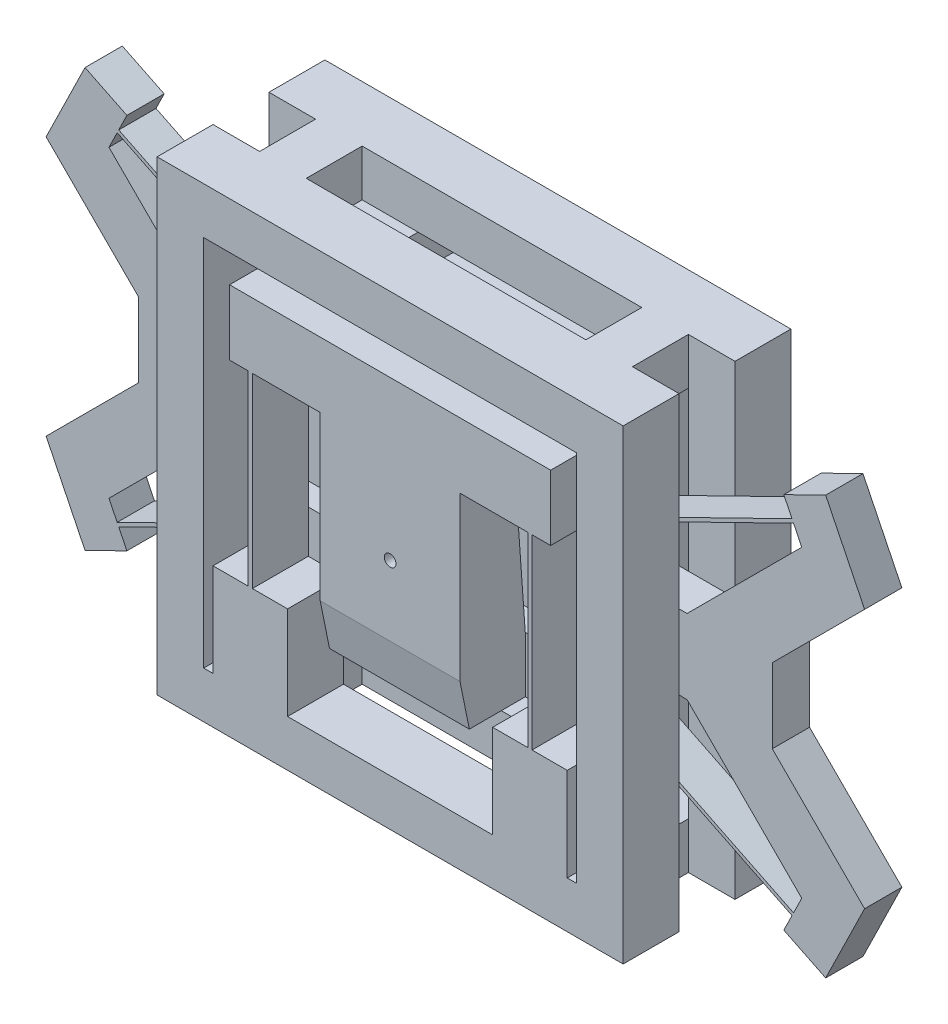
from build123d import *

# Parameters (mm, degrees)
SKETCH1_W           = 100
SKETCH1_H           = 100
BOSS_EXTRUDE1_DEPTH = 12
BOSS_EXTRUDE2_DEPTH = 30
BOSS_EXTRUDE3_DEPTH = 8
BOSS_EXTRUDE4_DEPTH = 30
SKETCH8_W           = 100
SKETCH8_H           = 100
BOSS_EXTRUDE5_DEPTH = 12
SKETCH9_W           = 10
SKETCH9_H           = 10
BOSS_EXTRUDE6_DEPTH = 12
SKETCH19_R          = 1.25
CUT_EXTRUDE3_DEPTH  = 6
CUT_EXTRUDE4_START  = -6
SKETCH20_R          = 1.25
CUT_EXTRUDE4_DEPTH  = 6


with BuildPart() as part:
    # Sketch1 → Boss-Extrude1 (new body)
    with BuildSketch(Plane.XY):
        Rectangle(SKETCH1_W, SKETCH1_H)
        Polygon((-20, -38), (-20, -30.45), (20, -30.45), (20, -34.45), (34, -34.45), (34, 34.45), (20, 34.45), (20, 30.45), (-20, 30.45), (-20, 38), (-40, 38), (-40, 40), (40, 40), (40, -40), (-40, -40), (-40, -38), align=None, mode=Mode.SUBTRACT)
        Polygon((-20, -29.55), (-20, -22), (-40, -22), (-40, 22), (-20, 22), (-20, 29.55), (20, 29.55), (20, 15), (-15, 15), (-15, -15), (20, -15), (20, -29.55), align=None, mode=Mode.SUBTRACT)
    extrude(amount=BOSS_EXTRUDE1_DEPTH)

    # Sketch3 → Boss-Extrude2 (add)
    with BuildSketch(Plane.ZY.offset(15)):
        Polygon((14, 12.85), (14, 24.85), (0, 15), (12, 15), (12, -15), align=None)
    extrude(amount=-BOSS_EXTRUDE2_DEPTH)

    # Sketch4 → Boss-Extrude3 (add)
    with BuildSketch(Plane.XY.offset(14)):
        Polygon((-15, 12.85), (-15, 24.85), (-33.36063033, 24.85), (-36.135022811, 19.186760341), (-72.235731357, 36.872314969), (-70.475974677, 40.464425272), (-79.456250435, 44.863816971), (-87.810556524, 27.810556524), (-68, 8), (-68, 0), (-60, 0), (0, 0), (0, 8), (-49.718758429, 8), (-74.325442414, 32.606683984), (-72.565685734, 36.198794287), (-36.464977189, 18.513239659), (-39.23936967, 12.85), align=None)
        Polygon((15, 24.85), (15, 12.85), (39.23936967, 12.85), (36.464977189, 18.513239659), (72.565685734, 36.198794287), (74.325442414, 32.606683984), (49.718758429, 8), (0, 8), (0, 0), (60, 0), (68, 0), (68, 8), (87.810556524, 27.810556524), (79.456250435, 44.863816971), (70.475974677, 40.464425272), (72.235731357, 36.872314969), (36.135022811, 19.186760341), (33.36063033, 24.85), align=None)
        Polygon((6, 24.85), (0, 24.85), (0, 12.85), (15, 12.85), (15, 24.85), align=None)
        Polygon((0, 24.85), (-6, 24.85), (-15, 24.85), (-15, 12.85), (0, 12.85), align=None)
    boss_extrude3 = extrude(amount=BOSS_EXTRUDE3_DEPTH)

    # Mirror6: Boss-Extrude3 across plane
    add(boss_extrude3.mirror(Plane(origin=(0, 0, 22), x_dir=(0, 0, 1), z_dir=(0, 1, 0))))

    # Sketch7 → Boss-Extrude4 (add)
    with BuildSketch(Plane(origin=(15, 0, 0), x_dir=(0, -1, 0), z_dir=(-1, 0, 0))):
        Polygon((24.85, 22), (12.85, 22), (-15, 24), (15, 24), (15, 36), (24.85, 34), align=None)
    extrude(amount=BOSS_EXTRUDE4_DEPTH)

    # Sketch8 → Boss-Extrude5 (add)
    with BuildSketch(Plane.XY.offset(24)):
        Rectangle(SKETCH8_W, SKETCH8_H)
        Polygon((15, -15), (15, 20), (29.55, 20), (29.55, -20), (22, -20), (22, -40), (-22, -40), (-22, -20), (-29.55, -20), (-29.55, 20), (-15, 20), (-15, -15), align=None, mode=Mode.SUBTRACT)
        Polygon((38, -20), (30.45, -20), (30.45, 20), (34.45, 20), (34.45, 34), (-34.45, 34), (-34.45, 20), (-30.45, 20), (-30.45, -20), (-38, -20), (-38, -40), (-40, -40), (-40, 40), (40, 40), (40, -40), (38, -40), align=None, mode=Mode.SUBTRACT)
    extrude(amount=BOSS_EXTRUDE5_DEPTH)

    # Sketch9 → Boss-Extrude6 (add)
    with BuildSketch(Plane.XY.offset(12)):
        with Locations((35, -45)):
            Rectangle(SKETCH9_W, SKETCH9_H)
        with Locations((-35, -45)):
            Rectangle(SKETCH9_W, SKETCH9_H)
        with Locations((-35, 45)):
            Rectangle(SKETCH9_W, SKETCH9_H)
        with Locations((35, 45)):
            Rectangle(SKETCH9_W, SKETCH9_H)
    extrude(amount=BOSS_EXTRUDE6_DEPTH)

    # Sketch19 → Cut-Extrude3 (cut)
    with BuildSketch(Plane.XY.offset(36)):
        Circle(SKETCH19_R)
    extrude(amount=-CUT_EXTRUDE3_DEPTH, mode=Mode.SUBTRACT)

    # Sketch20 → Cut-Extrude4 (cut)
    with BuildSketch(Plane(origin=(0, 0, 0), x_dir=(-1, 0, 0), z_dir=(0, 0, -1)).offset(CUT_EXTRUDE4_START)):
        with Locations(Location((0, 0, 0), (0, 0, 180))):
            Circle(SKETCH20_R)
    extrude(amount=CUT_EXTRUDE4_DEPTH, mode=Mode.SUBTRACT)


solid = part.part
